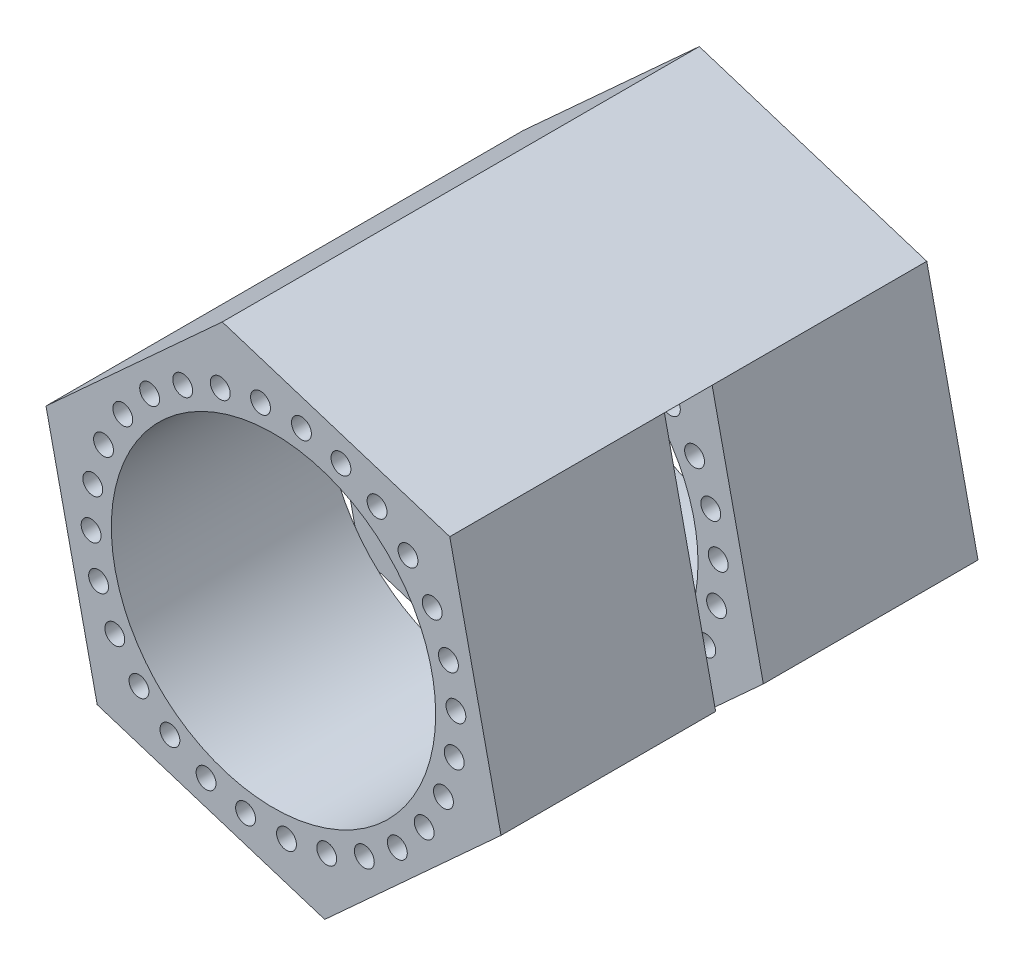
from build123d import *

# Parameters (mm, degrees)
SKETCH1_R           = 12.954
BOSS_EXTRUDE2_DEPTH = 38.1
SKETCH2_R           = 0.79375
CUT_EXTRUDE1_DEPTH  = 38.1
CUT_EXTRUDE3_DEPTH  = 1.905


with BuildPart() as part:
    # Sketch1 → Boss-Extrude2 (new body)
    with BuildSketch(Plane(origin=(0, 0, 0), x_dir=(0, 1, 0), z_dir=(0, 0, 1))):
        Polygon((12.85291169, -14.079871961), (18.619982645, 4.091012056), (5.767070955, 18.170884016), (-12.85291169, 14.079871961), (-18.619982645, -4.091012056), (-5.767070955, -18.170884016), align=None)
        with Locations(Location((0, 0, 0), (0, 0, 90))):
            Circle(SKETCH1_R, mode=Mode.SUBTRACT)
    extrude(amount=BOSS_EXTRUDE2_DEPTH)

    # Sketch2 → Cut-Extrude1 (cut)
    with BuildSketch(Plane.XY.offset(38.1)):
        with Locations((-13.57512855, 5.387198703)):
            Circle(SKETCH2_R)
        with Locations((-12.036007248, 8.272880667)):
            Circle(SKETCH2_R)
        with Locations((-9.893350284, 10.743725851)):
            Circle(SKETCH2_R)
        with Locations((-7.254599427, 12.675835758)):
            Circle(SKETCH2_R)
        with Locations((-4.252072661, 13.97232633)):
            Circle(SKETCH2_R)
        with Locations((-1.036329218, 14.568186117)):
            Circle(SKETCH2_R)
        with Locations((2.2313801, 14.433536221)):
            Circle(SKETCH2_R)
        with Locations((5.387198703, 13.57512855)):
            Circle(SKETCH2_R)
        with Locations((8.272880667, 12.036007248)):
            Circle(SKETCH2_R)
        with Locations((10.743725851, 9.893350284)):
            Circle(SKETCH2_R)
        with Locations((12.675835758, 7.254599427)):
            Circle(SKETCH2_R)
        with Locations((13.97232633, 4.252072661)):
            Circle(SKETCH2_R)
        with Locations((14.568186117, 1.036329218)):
            Circle(SKETCH2_R)
        with Locations((14.433536221, -2.2313801)):
            Circle(SKETCH2_R)
        with Locations((13.57512855, -5.387198703)):
            Circle(SKETCH2_R)
        with Locations((12.036007248, -8.272880667)):
            Circle(SKETCH2_R)
        with Locations((9.893350284, -10.743725851)):
            Circle(SKETCH2_R)
        with Locations((7.254599427, -12.675835758)):
            Circle(SKETCH2_R)
        with Locations((4.252072661, -13.97232633)):
            Circle(SKETCH2_R)
        with Locations((1.036329218, -14.568186117)):
            Circle(SKETCH2_R)
        with Locations((-2.2313801, -14.433536221)):
            Circle(SKETCH2_R)
        with Locations((-5.387198703, -13.57512855)):
            Circle(SKETCH2_R)
        with Locations((-8.272880667, -12.036007248)):
            Circle(SKETCH2_R)
        with Locations((-10.743725851, -9.893350284)):
            Circle(SKETCH2_R)
        with Locations((-12.675835758, -7.254599427)):
            Circle(SKETCH2_R)
        with Locations((-13.97232633, -4.252072661)):
            Circle(SKETCH2_R)
        with Locations((-14.568186117, -1.036329218)):
            Circle(SKETCH2_R)
        with Locations((-14.433536221, 2.2313801)):
            Circle(SKETCH2_R)
    extrude(amount=-CUT_EXTRUDE1_DEPTH, mode=Mode.SUBTRACT)

    # Sketch3 → Cut-Extrude3 (cut, symmetric)
    with BuildSketch(Plane(origin=(0, 0, 19.05), x_dir=(0, -1, 0), z_dir=(0, 0, 1))):
        with BuildLine():
            Line((-12.85291169, 14.079871961), (-8.733513074, 9.56722872))
            ThreePointArc((-8.733513074, 9.56722872), (12.652219652, 2.779829827), (-3.918706578, -12.347058547))
            Line((-3.918706578, -12.347058547), (-5.767070955, -18.170884016))
            Line((-5.767070955, -18.170884016), (12.85291169, -14.079871961))
            Line((12.85291169, -14.079871961), (18.619982645, 4.091012056))
            Line((18.619982645, 4.091012056), (5.767070955, 18.170884016))
            Line((5.767070955, 18.170884016), (-12.85291169, 14.079871961))
        make_face()
    extrude(amount=CUT_EXTRUDE3_DEPTH, both=True, mode=Mode.SUBTRACT)


solid = part.part
